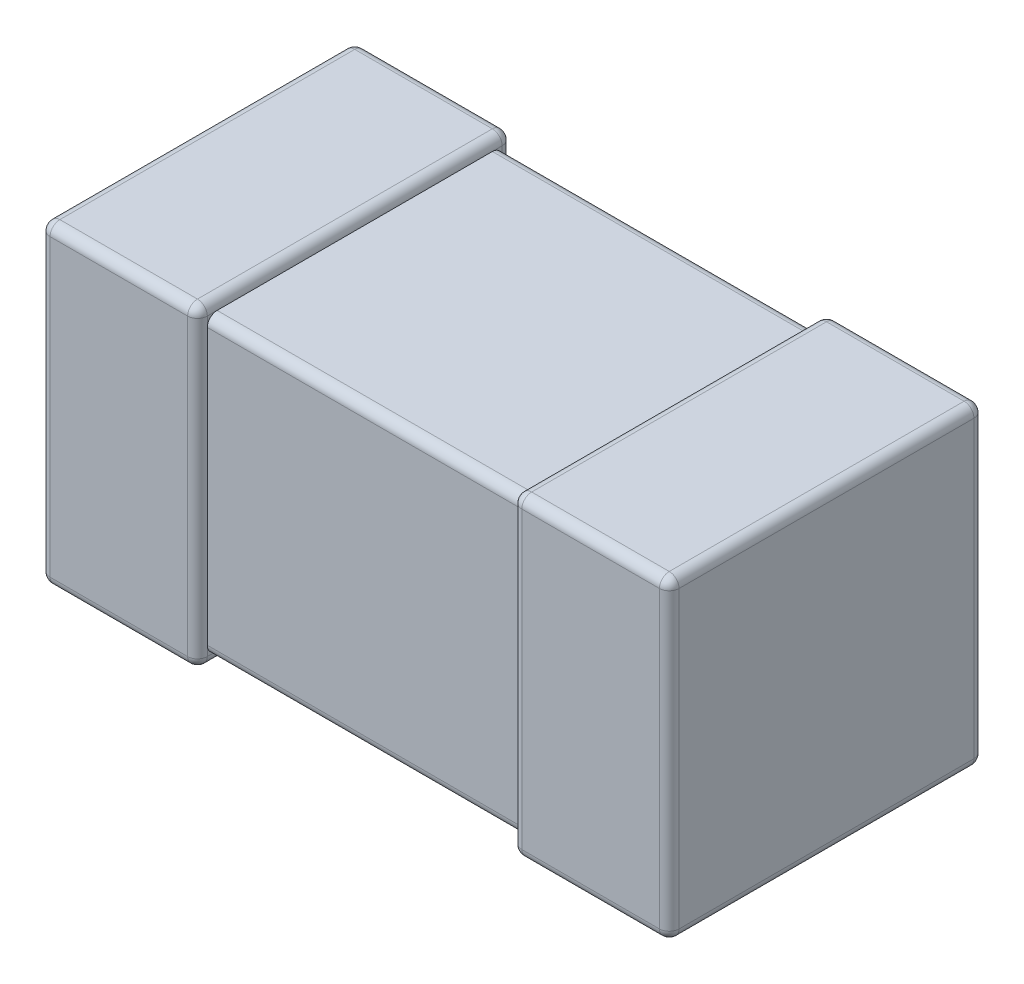
from build123d import *

# Parameters (mm, degrees)
SKETCH1_W             = 3.1
SKETCH1_H             = 1.5
BOSS_EXTRUDE1_DEPTH   = 1.5
SKETCH2_W             = 0.8
SKETCH2_H             = 1.6
BOSS_EXTRUDE2_DEPTH   = 1.6
BOSS_EXTRUDE2_2_DEPTH = 1.6
FILLET1_R             = 0.05
FILLET2_R             = 0.05
FILLET3_R             = 0.05


with BuildPart() as part:
    # Sketch1 → Boss-Extrude1 (new body)
    with BuildSketch(Plane(origin=(0, 0.05, 0), x_dir=(1, 0, 0), z_dir=(0, 1, 0))):
        Rectangle(SKETCH1_W, SKETCH1_H)
    extrude(amount=BOSS_EXTRUDE1_DEPTH)

    # Fillet3
    fillet3_edges = [part.edges().sort_by_distance(p)[0] for p in [
        (1.55, 1.55, 0),
        (0, 1.55, -0.75),
        (-1.55, 1.55, 0),
        (0, 0.05, -0.75),
        (1.55, 0.05, 0),
        (0, 0.05, 0.75),
        (-1.55, 0.05, 0),
        (-1.55, 0.8, -0.75),
        (1.55, 0.8, -0.75),
        (1.55, 0.8, 0.75),
        (-1.55, 0.8, 0.75),
        (0, 1.55, 0.75),
    ]]
    fillet(fillet3_edges, radius=FILLET3_R)


with BuildPart() as body_2:
    # Sketch2 → Boss-Extrude2 (new body)
    with BuildSketch(Plane(origin=(0, 0, 0), x_dir=(1, 0, 0), z_dir=(0, 1, 0))):
        with Locations((-1.2, 0)):
            Rectangle(SKETCH2_W, SKETCH2_H)
    extrude(amount=BOSS_EXTRUDE2_DEPTH)

    # Fillet2
    fillet2_edges = [body_2.edges().sort_by_distance(p)[0] for p in [
        (-1.6, 0.8, 0.8),
        (-1.2, 0, 0.8),
        (-0.8, 0.8, 0.8),
        (-0.8, 0, 0),
        (-0.8, 0.8, -0.8),
        (-1.2, 0, -0.8),
        (-1.2, 1.6, -0.8),
        (-1.6, 1.6, 0),
        (-1.2, 1.6, 0.8),
        (-0.8, 1.6, 0),
        (-1.6, 0.8, -0.8),
        (-1.6, 0, 0),
    ]]
    fillet(fillet2_edges, radius=FILLET2_R)


with BuildPart() as body_3:
    # Sketch2 → Boss-Extrude2 2 (new body)
    with BuildSketch(Plane(origin=(0, 0, 0), x_dir=(1, 0, 0), z_dir=(0, 1, 0))):
        with Locations((1.2, 0)):
            Rectangle(SKETCH2_W, SKETCH2_H)
    extrude(amount=BOSS_EXTRUDE2_2_DEPTH)

    # Fillet1
    fillet1_edges = [body_3.edges().sort_by_distance(p)[0] for p in [
        (0.8, 0.8, -0.8),
        (0.8, 0, 0),
        (0.8, 0.8, 0.8),
        (1.2, 0, 0.8),
        (1.6, 0.8, 0.8),
        (1.6, 0, 0),
        (1.6, 0.8, -0.8),
        (1.2, 0, -0.8),
        (1.2, 1.6, -0.8),
        (0.8, 1.6, 0),
        (1.2, 1.6, 0.8),
        (1.6, 1.6, 0),
    ]]
    fillet(fillet1_edges, radius=FILLET1_R)


solid = Compound([part.part, body_2.part, body_3.part])
